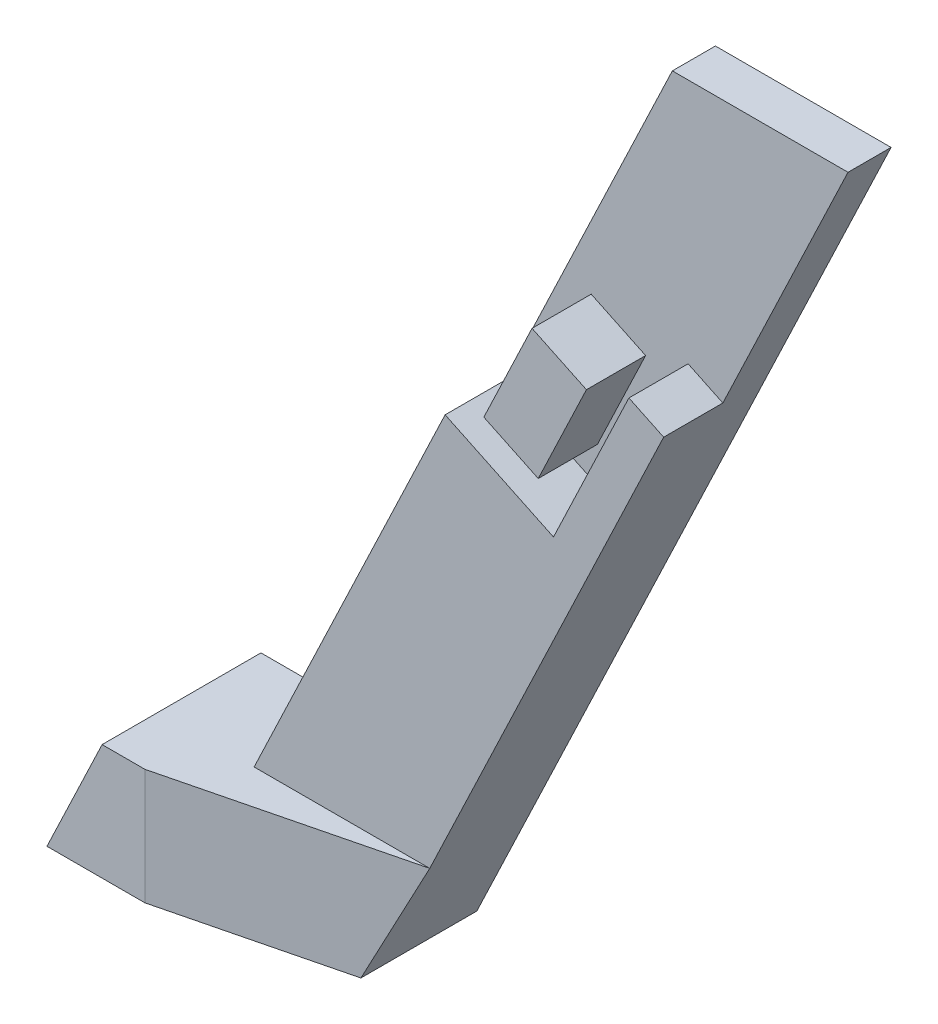
from build123d import *

# Parameters (mm, degrees)
BOSS_EXTRUDE1_DEPTH = 4
BOSS_EXTRUDE2_DEPTH = 5.5
BOSS_EXTRUDE3_DEPTH = 5.26
CUT_EXTRUDE1_DEPTH  = 25.26
SKETCH5_W           = 16.298124665
SKETCH5_H           = 32.903045357
BOSS_EXTRUDE4_DEPTH = 10
SKETCH6_W           = 73.83328153
SKETCH6_H           = 41.567802575
CUT_EXTRUDE2_DEPTH  = 120
SKETCH7_W           = 16.298124665
SKETCH7_H           = 10
CUT_EXTRUDE3_DEPTH  = 120


with BuildPart() as part:
    # Sketch1 → Boss-Extrude1 (new body)
    with BuildSketch(Plane.XY):
        Polygon((6.798067323, 45.385579117), (-26.566371189, -24.564420883), (-35.429799542, -24.564420883), (-40.556683823, -35.313157307), (-15.371402202, -35.313157307), (23.119920592, 45.385579117), align=None)
    boss_extrude1 = extrude(amount=-BOSS_EXTRUDE1_DEPTH)

    # Sketch2 → Boss-Extrude2 (add)
    with BuildSketch(Plane(origin=(0, 0, -4), x_dir=(-1, 0, 0), z_dir=(0, 0, -1))):
        Polygon((5.218881417, 14.259069333), (0.74156601, 23.645956291), (-4.312911582, 21.235094148), (0.164403825, 11.848207191), align=None)
        Polygon((40.556683823, -35.313157307), (35.429799542, -24.564420883), (26.566371189, -24.564420883), (8.815605583, 12.650833126), (-1.251818738, 7.848918048), (-8.260923666, 22.543811707), (-11.490263359, 21.003495686), (15.371402202, -35.313157307), align=None)
    boss_extrude2 = extrude(amount=BOSS_EXTRUDE2_DEPTH)

    # Sketch3 → Boss-Extrude3 (add)
    with BuildSketch(Plane(origin=(0, 0, -9.5), x_dir=(-1, 0, 0), z_dir=(0, 0, -1))):
        Polygon((40.556683823, -35.313157307), (35.429799542, -24.564420883), (10.244517921, -24.564420883), (15.371402202, -35.313157307), align=None)
    boss_extrude3 = extrude(amount=BOSS_EXTRUDE3_DEPTH)

    # Sketch4 → Cut-Extrude1 (cut)
    with BuildSketch(Plane.XZ.offset(35.313157307)):
        Polygon((-31.448639935, -14.76), (-10.244517921, -9.5), (-10.244517921, -14.76), align=None)
    cut_extrude1 = extrude(amount=-CUT_EXTRUDE1_DEPTH, mode=Mode.SUBTRACT)


with BuildPart() as body_2:
    # Sketch5 → Boss-Extrude4 (new body)
    with BuildSketch(Plane(origin=(0, 45.385579117, 0), x_dir=(1, 0, 0), z_dir=(0, 1, 0))):
        with Locations((14.947129656, -12.451522679)):
            Rectangle(SKETCH5_W, SKETCH5_H)
    extrude(amount=BOSS_EXTRUDE4_DEPTH)

    # Mirror8: Boss-Extrude1, Boss-Extrude2, Boss-Extrude3, Cut-Extrude1 across plane
    add(boss_extrude1.mirror(Plane.XY.offset(12.451522678)))
    add(boss_extrude2.mirror(Plane.XY.offset(12.451522678)))
    add(boss_extrude3.mirror(Plane.XY.offset(12.451522678)))
    add(cut_extrude1.mirror(Plane.XY.offset(12.451522678)), mode=Mode.SUBTRACT)


with BuildPart() as cut_extrude2_tool:
    # Sketch6 → Cut-Extrude2 (new body)
    with BuildSketch(Plane.XZ.offset(35.313157307)):
        with Locations((-3.640043058, 4.119144069)):
            Rectangle(SKETCH6_W, SKETCH6_H)
    extrude(amount=-CUT_EXTRUDE2_DEPTH)


with BuildPart() as part_1:
    add(part.part)

    # Cut-Extrude2: cut by cut_extrude2_tool
    add(cut_extrude2_tool.part, mode=Mode.SUBTRACT)


with BuildPart() as body_2_1:
    add(body_2.part)

    # Cut-Extrude2: cut by cut_extrude2_tool
    add(cut_extrude2_tool.part, mode=Mode.SUBTRACT)

    # Sketch7 → Cut-Extrude3 (cut)
    with BuildSketch(Plane.XY.offset(28.903045357)):
        with Locations((14.947129656, 50.385579117)):
            Rectangle(SKETCH7_W, SKETCH7_H)
    extrude(amount=-CUT_EXTRUDE3_DEPTH, mode=Mode.SUBTRACT)


solid = body_2_1.part
